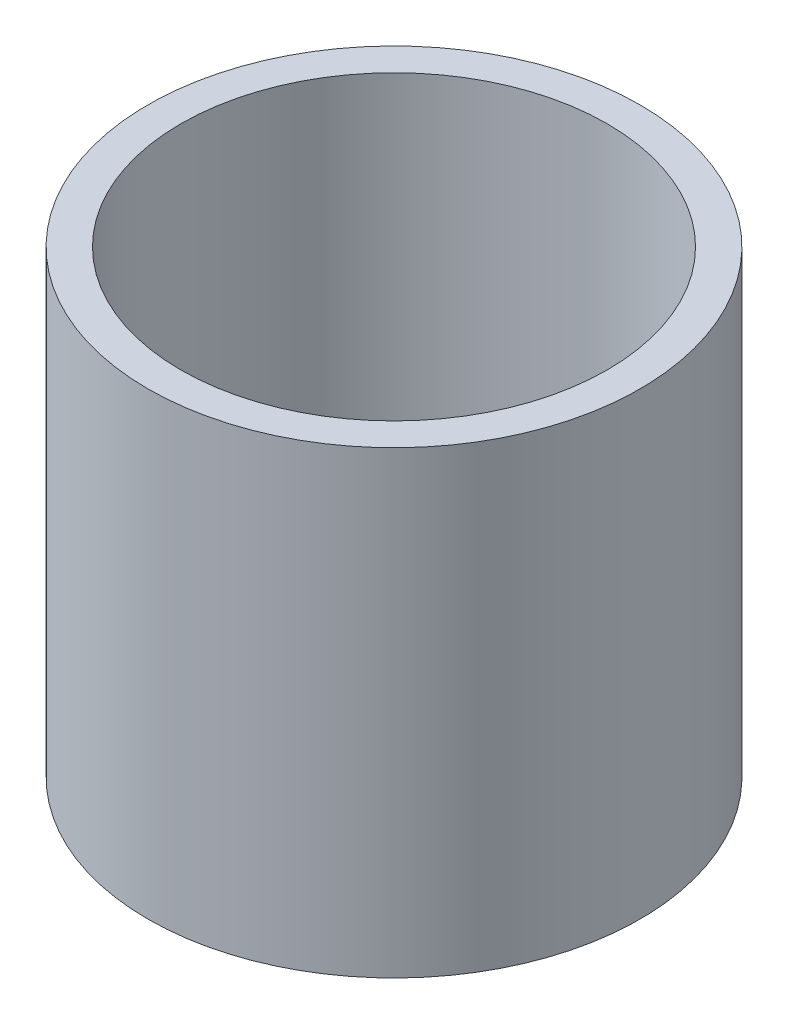
from build123d import *

# Parameters (mm, degrees)
SKETCH_1_R          = 37.5
EXTRUDE_1_DEPTH     = 70
SKETCH_2_R          = 32.5
CUT_EXTRUDE_1_DEPTH = 60
SKETCH_3_R          = 14.5
CUT_EXTRUDE_2_DEPTH = 40


with BuildPart() as part:
    # 草图1 → 凸台-拉伸1 (new body)
    with BuildSketch(Plane(origin=(0, 0, 0), x_dir=(1, 0, 0), z_dir=(0, 1, 0))):
        with Locations(Location((0, 0, 0), (0, 0, 270))):
            Circle(SKETCH_1_R)
    extrude(amount=EXTRUDE_1_DEPTH)

    # 草图2 → 切除-拉伸1 (cut)
    with BuildSketch(Plane(origin=(0, 70, 0), x_dir=(1, 0, 0), z_dir=(0, 1, 0))):
        with Locations(Location((0, 0, 0), (0, 0, 270))):
            Circle(SKETCH_2_R)
    extrude(amount=-CUT_EXTRUDE_1_DEPTH, mode=Mode.SUBTRACT)

    # 草图3 → 切除-拉伸2 (cut)
    with BuildSketch(Plane.XZ):
        with Locations(Location((0, 0, 0), (0, 0, 270))):
            Circle(SKETCH_3_R)
    extrude(amount=-CUT_EXTRUDE_2_DEPTH, mode=Mode.SUBTRACT)


solid = part.part
